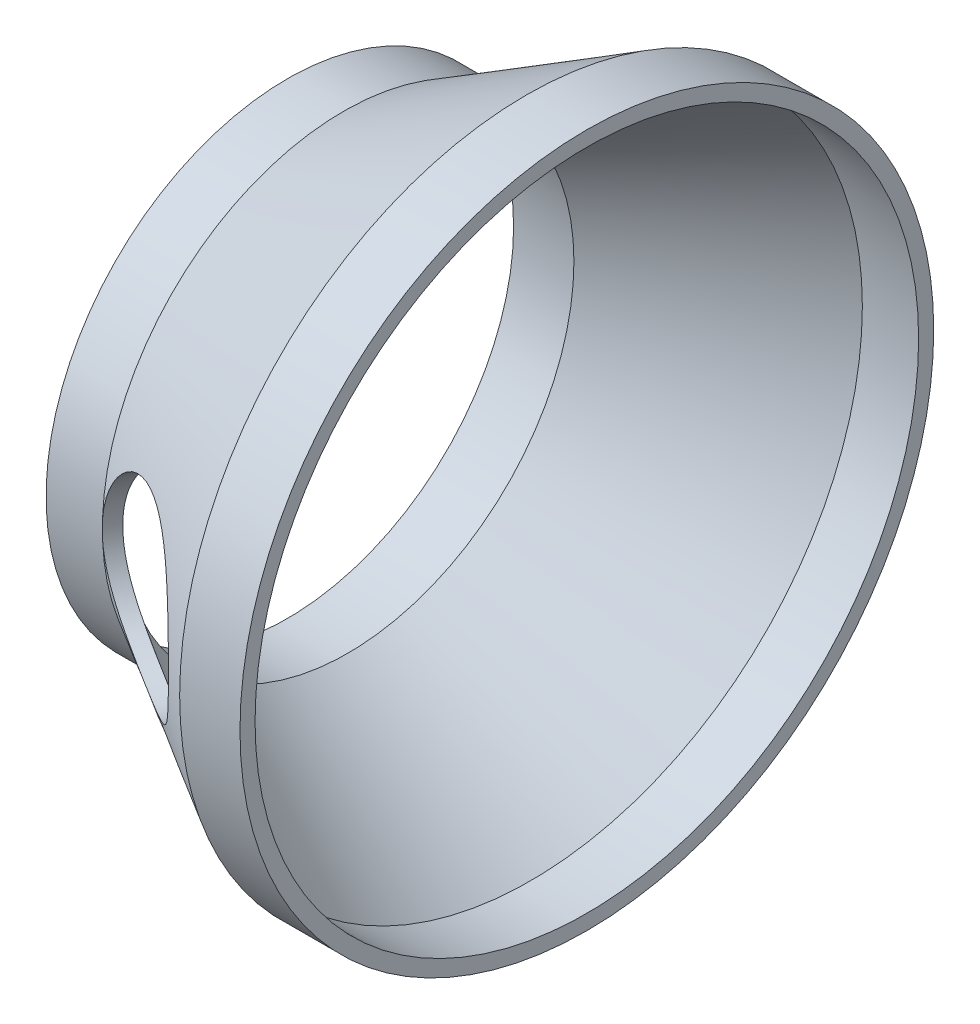
from build123d import *

# Parameters (mm, degrees)
CUT_EXTRUDE1_REACH = 157.918
SKETCH2_R          = 19.05


with BuildPart() as part:
    # Sketch1 → Revolve1 (revolve)
    with BuildSketch(Plane.XY, mode=Mode.PRIVATE) as revolve1_sk:
        Polygon((0, 69.85), (0, 73.025), (-12.7, 73.025), (-51.194829198, 50.8), (-63.044090512, 50.8), (-63.044090512, 47.625), (-50.344090512, 47.625), (-11.849261314, 69.85), align=None)
    revolve(revolve1_sk.sketch.rotate(Axis((0, 0, 0), (-1, 0, 0)), 90), axis=Axis((0, 0, 0), (-1, 0, 0)))

    # Cut-Extrude1: up to this cone (the profile starts outside it)
    cut_extrude1_end = Plane(origin=(-34.795753, 0, 0), z_dir=(1, 0, 0)).offset(-98.037256223) * Cone(1e-06, 180.743597534, 313.057093071, align=(Align.CENTER, Align.CENTER, Align.MIN), mode=Mode.PRIVATE)
    # Sketch2 → Cut-Extrude1 (cut, up to the surface)
    with BuildSketch(Plane(origin=(-34.795752556, 0, 60.268011314), x_dir=(0.8660254037844378, 0, 0.5000000000000017), z_dir=(-0.5000000000000016, 0, 0.8660254037844377)), mode=Mode.PRIVATE) as cut_extrude1_sk1:
        with Locations(Location((0, 0, 0), (0, 0, 221.978854454))):
            Circle(SKETCH2_R)
    cut_extrude1_tool1 = extrude(cut_extrude1_sk1.sketch, amount=-CUT_EXTRUDE1_REACH, mode=Mode.PRIVATE) - cut_extrude1_end
    add(cut_extrude1_tool1.solids().sort_by_distance((-34.795753, 0, 60.268011))[0], mode=Mode.SUBTRACT)


solid = part.part
